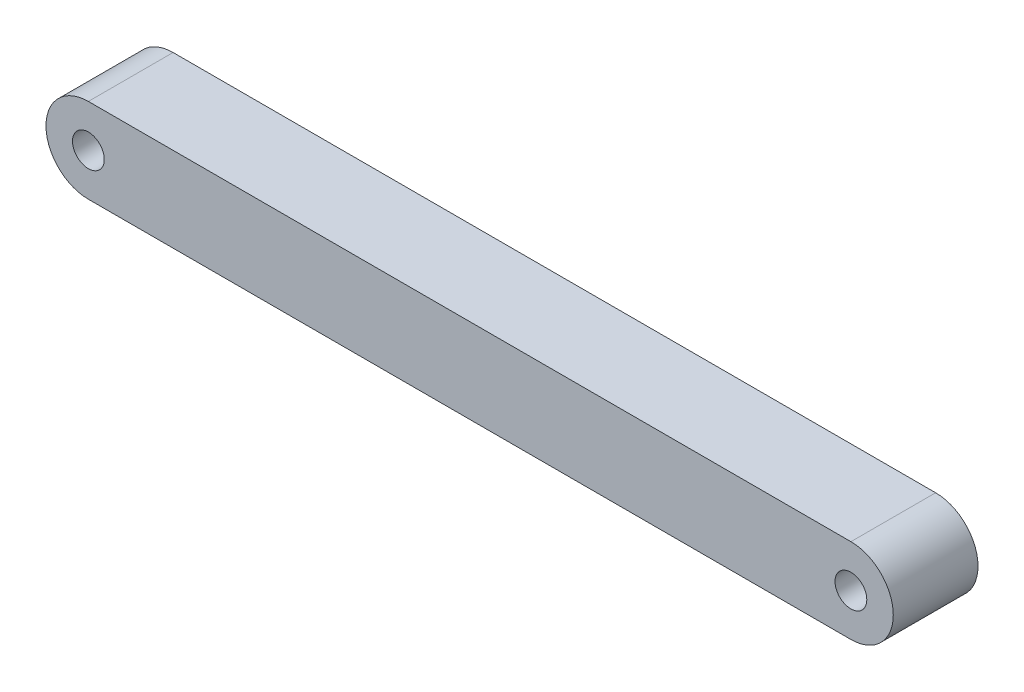
from build123d import *

# Parameters (mm, degrees)
SKETCH1_R           = 1.5
BOSS_EXTRUDE1_DEPTH = 8


with BuildPart() as part:
    # Sketch1 → Boss-Extrude1 (new body)
    with BuildSketch(Plane.XY):
        with BuildLine():
            Line((-36, 4), (36, 4))
            ThreePointArc((36, 4), (40, 0), (36, -4))
            Line((36, -4), (-36, -4))
            ThreePointArc((-36, -4), (-40, 0), (-36, 4))
        make_face()
        with Locations((36, 0)):
            Circle(SKETCH1_R, mode=Mode.SUBTRACT)
        with Locations((-36, 0)):
            Circle(SKETCH1_R, mode=Mode.SUBTRACT)
    extrude(amount=BOSS_EXTRUDE1_DEPTH)


solid = part.part
